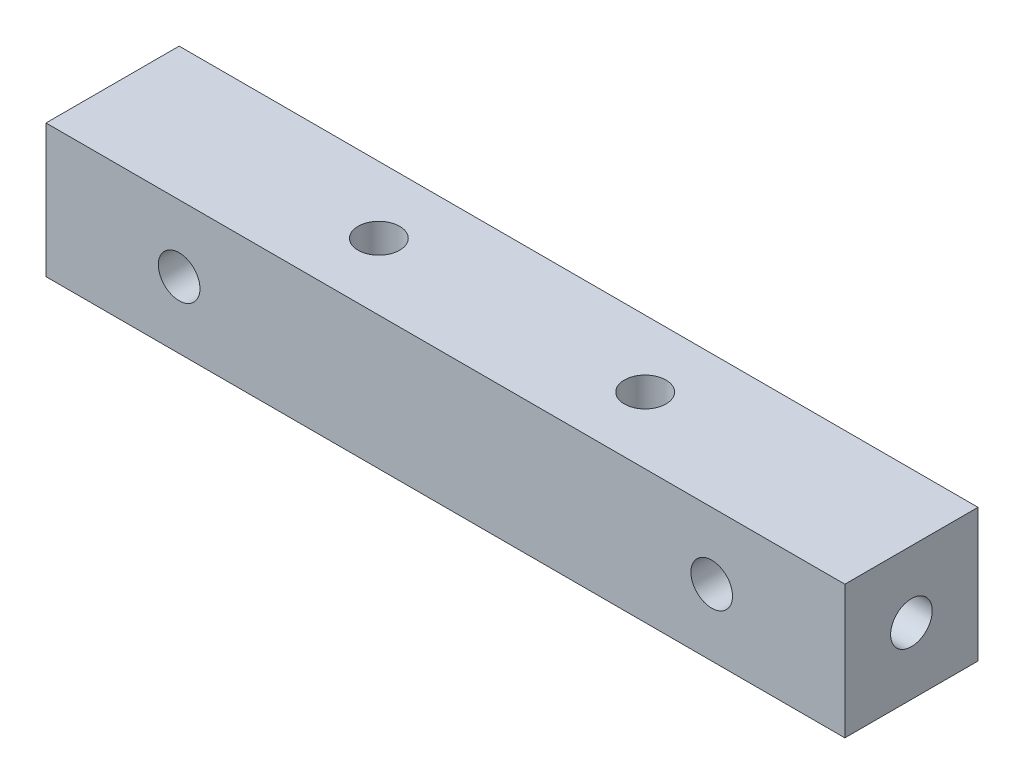
from build123d import *

# Parameters (mm, degrees)
SKETCH_1_W         = 48
SKETCH_1_H         = 8
EXTRUDE_1_DEPTH    = 8
HOLE_WIZARD_M3_1_D = 2.5
HOLE_WIZARD_M3_2_D = 2.5
HOLE_WIZARD_M3_3_D = 2.5
HOLE_WIZARD_M3_4_D = 2.5
HOLE_WIZARD_M3_5_D = 2.5


with BuildPart() as part:
    # 草图1 → 凸台-拉伸1 (new body)
    with BuildSketch(Plane.XY):
        Rectangle(SKETCH_1_W, SKETCH_1_H)
    extrude(amount=EXTRUDE_1_DEPTH)

    # M3 螺纹孔的螺纹孔钻头1 (through all)
    with Locations(Plane(origin=(-24, 0, 4), x_dir=(0, 0, -1), z_dir=(-1, 0, 0))):
        with Locations((0, 0)):
            Hole(HOLE_WIZARD_M3_1_D / 2)

    # M3 螺纹孔的螺纹孔钻头2 (through all)
    with Locations(Plane(origin=(-16, 0, 8), x_dir=(1, 0, 0), z_dir=(0, 0, 1))):
        with Locations((0, 0)):
            Hole(HOLE_WIZARD_M3_2_D / 2)

    # M3 螺纹孔的螺纹孔钻头3 (through all)
    with Locations(Plane(origin=(16, 0, 8), x_dir=(1, 0, 0), z_dir=(0, 0, 1))):
        with Locations((0, 0)):
            Hole(HOLE_WIZARD_M3_3_D / 2)

    # M3 螺纹孔的螺纹孔钻头4 (through all)
    with Locations(Plane(origin=(-8, 4, 4), x_dir=(1, 0, 0), z_dir=(0, 1, 0))):
        with Locations((0, 0)):
            Hole(HOLE_WIZARD_M3_4_D / 2)

    # M3 螺纹孔的螺纹孔钻头5 (through all)
    with Locations(Plane(origin=(8, 4, 4), x_dir=(1, 0, 0), z_dir=(0, 1, 0))):
        with Locations((0, 0)):
            Hole(HOLE_WIZARD_M3_5_D / 2)


solid = part.part
